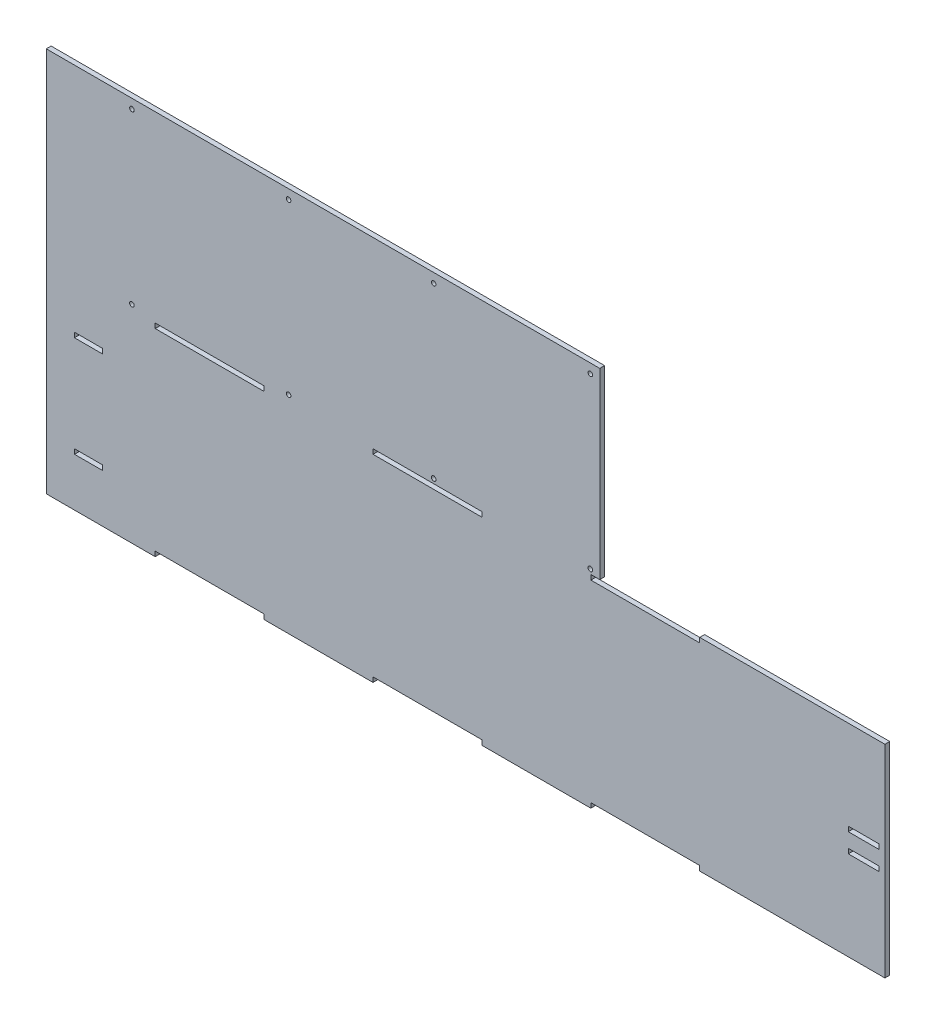
from build123d import *

# Parameters (mm, degrees)
SKETCH1_R           = 1.5
SKETCH1_W           = 71.428571428
SKETCH1_H           = 3.175
SKETCH1_W_2         = 20
SKETCH1_W_3         = 18.5
BOSS_EXTRUDE1_DEPTH = 3.175


with BuildPart() as part:
    # Sketch1 → Boss-Extrude1 (new body)
    with BuildSketch(Plane.XY):
        Polygon((0, 0), (0, 132.75), (0, 252.75), (328.222222222, 252.75), (363, 252.75), (363, 228.115), (363, 132.75), (357.142857143, 132.75), (357.142857143, 129.575), (428.571428571, 129.575), (428.571428571, 132.75), (550, 132.75), (550, 0), (428.571428571, 0), (428.571428571, 3.175), (357.142857143, 3.175), (357.142857143, 0), (285.714285714, 0), (285.714285714, 3.175), (214.285714286, 3.175), (214.285714286, 0), (142.857142857, 0), (142.857142857, 3.175), (71.428571429, 3.175), (71.428571429, 0), align=None)
        with Locations((56.175, 246.575)):
            Circle(SKETCH1_R, mode=Mode.SUBTRACT)
        with Locations((158.920833333, 135.75)):
            Circle(SKETCH1_R, mode=Mode.SUBTRACT)
        with Locations((158.920833333, 246.575)):
            Circle(SKETCH1_R, mode=Mode.SUBTRACT)
        with Locations((254.079166667, 246.575)):
            Circle(SKETCH1_R, mode=Mode.SUBTRACT)
        with Locations((254.079166667, 135.75)):
            Circle(SKETCH1_R, mode=Mode.SUBTRACT)
        with Locations((356.825, 135.75)):
            Circle(SKETCH1_R, mode=Mode.SUBTRACT)
        with Locations((356.825, 246.575)):
            Circle(SKETCH1_R, mode=Mode.SUBTRACT)
        with Locations((56.175, 135.75)):
            Circle(SKETCH1_R, mode=Mode.SUBTRACT)
        with Locations((107.142857143, 131.1625)):
            Rectangle(SKETCH1_W, SKETCH1_H, mode=Mode.SUBTRACT)
        with Locations((250, 131.1625)):
            Rectangle(SKETCH1_W, SKETCH1_H, mode=Mode.SUBTRACT)
        with Locations((536, 60.0875)):
            Rectangle(SKETCH1_W_2, SKETCH1_H, mode=Mode.SUBTRACT)
        with Locations((536, 72.6625)):
            Rectangle(SKETCH1_W_2, SKETCH1_H, mode=Mode.SUBTRACT)
        with Locations((27.75, 33.2875)):
            Rectangle(SKETCH1_W_3, SKETCH1_H, mode=Mode.SUBTRACT)
        with Locations((27.75, 99.4625)):
            Rectangle(SKETCH1_W_3, SKETCH1_H, mode=Mode.SUBTRACT)
    extrude(amount=BOSS_EXTRUDE1_DEPTH)


solid = part.part
